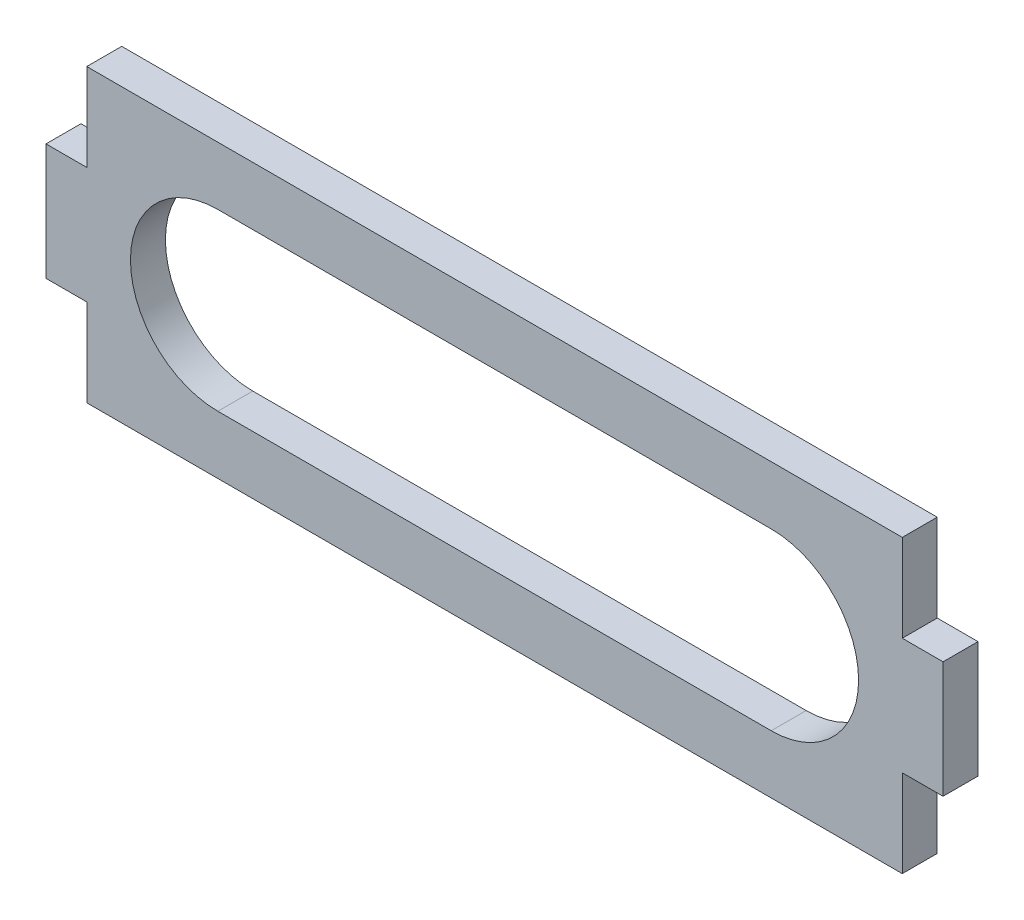
from build123d import *

# Parameters (mm, degrees)
BOSS_EXTRUDE1_DEPTH = 6


with BuildPart() as part:
    # Sketch1 → Boss-Extrude1 (new body)
    with BuildSketch(Plane.XY):
        Polygon((140, 0), (0, 0), (0, -15), (-7, -15), (-7, -35), (0, -35), (0, -50), (140, -50), (140, -35), (147, -35), (147, -15), (140, -15), align=None)
        with BuildLine():
            Line((117.5, -10), (22.5, -10))
            ThreePointArc((22.5, -10), (7.5, -25), (22.5, -40))
            Line((22.5, -40), (117.5, -40))
            ThreePointArc((117.5, -40), (132.5, -25), (117.5, -10))
        make_face(mode=Mode.SUBTRACT)
    extrude(amount=BOSS_EXTRUDE1_DEPTH)


solid = part.part
